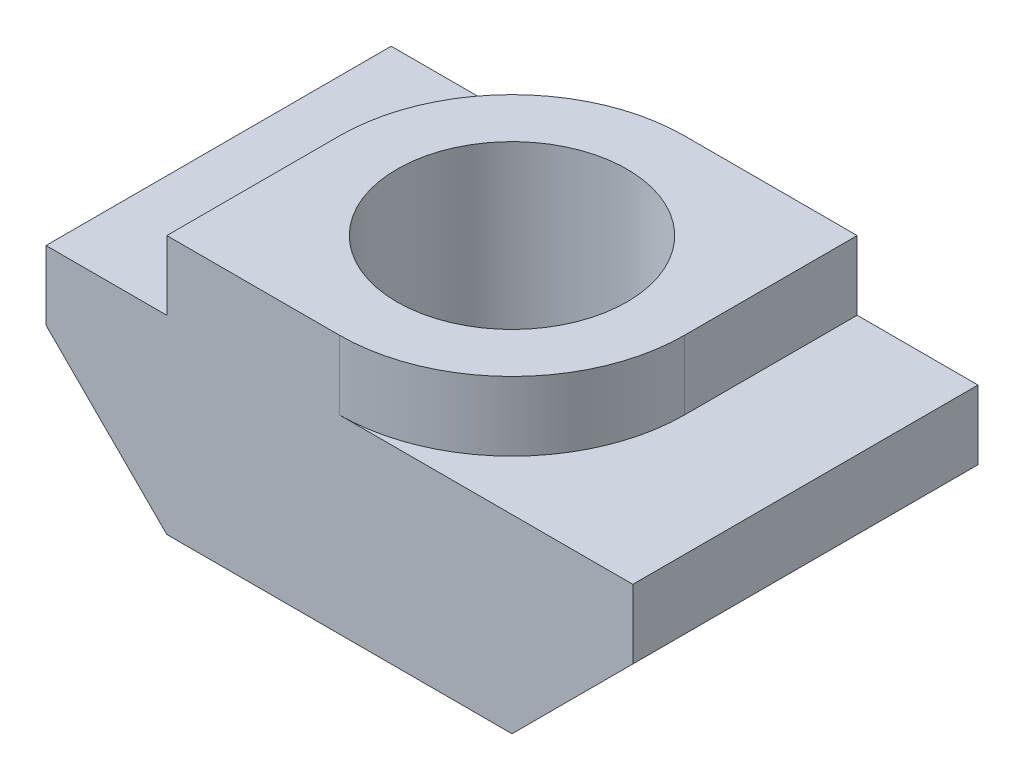
from build123d import *

# Parameters (mm, degrees)
SKETCH_1_W          = 10.2
SKETCH_1_H          = 6
EXTRUDE_1_DEPTH     = 3.3
EXTRUDE_START       = 3.3
EXTRUDE_2_DEPTH     = 1.2
CUT_EXTRUDE_2_DEPTH = 13.660568708
SKETCH_2_5_R        = 2
CUT_EXTRUDE_4_DEPTH = 13.660568708


with BuildPart() as part:
    # 草图1 → 凸台-拉伸1 (new body)
    with BuildSketch(Plane(origin=(0, 0, 0), x_dir=(1, 0, 0), z_dir=(0, 1, 0))):
        with Locations((5.1, 3)):
            Rectangle(SKETCH_1_W, SKETCH_1_H)
    extrude(amount=EXTRUDE_1_DEPTH)

    # 草图2 → 凸台-拉伸2 (add)
    with BuildSketch(Plane(origin=(0, 0, 0), x_dir=(1, 0, 0), z_dir=(0, 1, 0)).offset(EXTRUDE_START)):
        with BuildLine():
            Line((2.1, 3), (2.1, 0))
            Line((2.1, 0), (5.1, 0))
            ThreePointArc((5.1, 0), (7.221320344, 0.878679656), (8.1, 3))
            Line((8.1, 3), (8.1, 6))
            Line((8.1, 6), (5.1, 6))
            ThreePointArc((5.1, 6), (2.978679656, 5.121320344), (2.1, 3))
        make_face()
    extrude(amount=EXTRUDE_2_DEPTH)

    # 草图3 → 切除-拉伸2 (cut, through all)
    with BuildSketch(Plane.XY):
        Polygon((0, 2.1), (2.1, 0), (0, 0), align=None)
        Polygon((8.1, 0), (10.2, 2.1), (10.2, 0), align=None)
    extrude(amount=-CUT_EXTRUDE_2_DEPTH, mode=Mode.SUBTRACT)

    # 草图2<5> → 切除-拉伸4 (cut, through all)
    with BuildSketch(Plane(origin=(0, 0, 0), x_dir=(1, 0, 0), z_dir=(0, 1, 0))):
        with Locations(Location((5.1, 3, 0), (0, 0, 270))):
            Circle(SKETCH_2_5_R)
    extrude(amount=CUT_EXTRUDE_4_DEPTH, mode=Mode.SUBTRACT)


solid = part.part
